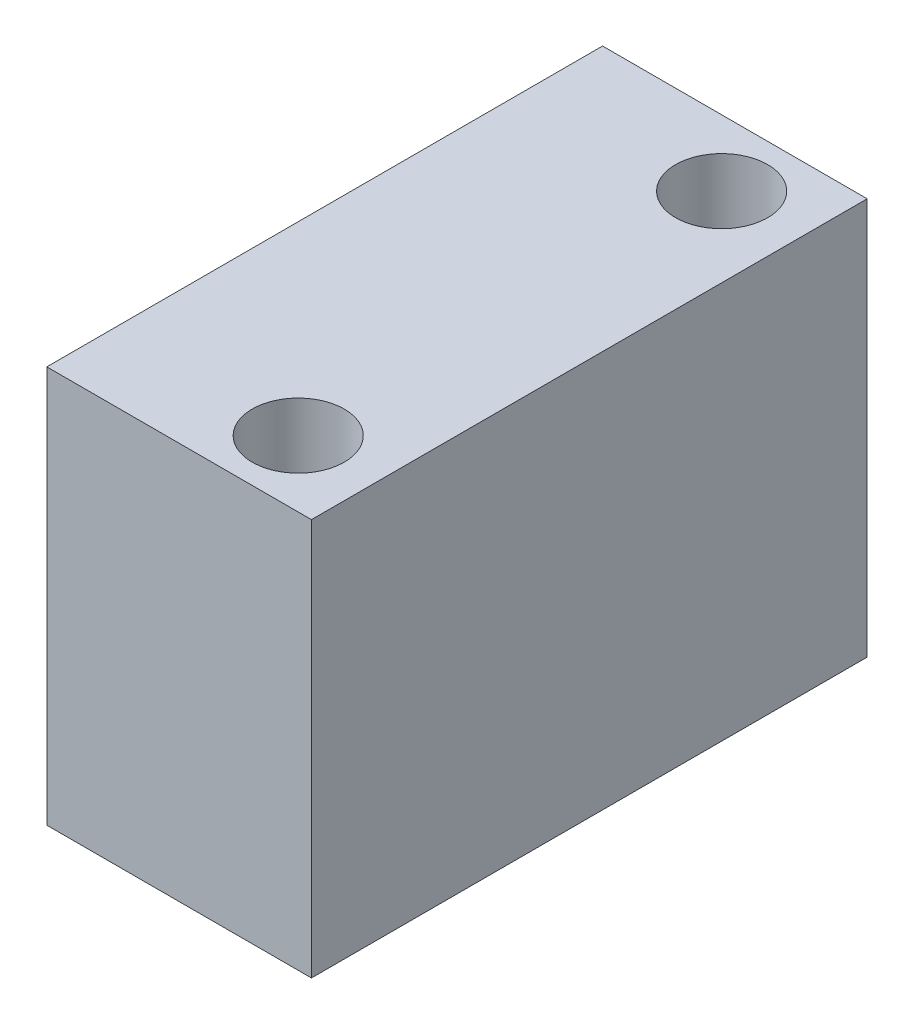
from build123d import *

# Parameters (mm, degrees)
SKETCH1_W           = 3.81
SKETCH1_H           = 13.335
SKETCH1_R           = 1.1049
BOSS_EXTRUDE1_DEPTH = 9.525
SKETCH2_W           = 2.54
SKETCH2_H           = 13.335
BOSS_EXTRUDE2_DEPTH = 9.525


with BuildPart() as part:
    # Sketch1 → Boss-Extrude1 (new body)
    with BuildSketch(Plane(origin=(0, 0, 0), x_dir=(1, 0, 0), z_dir=(0, 1, 0))):
        Rectangle(SKETCH1_W, SKETCH1_H)
        with Locations(Location((0, 5.08, 0), (0, 0, 90))):
            Circle(SKETCH1_R, mode=Mode.SUBTRACT)
        with Locations(Location((0, -5.08, 0), (0, 0, 90))):
            Circle(SKETCH1_R, mode=Mode.SUBTRACT)
    extrude(amount=BOSS_EXTRUDE1_DEPTH)

    # Sketch2 → Boss-Extrude2 (add)
    with BuildSketch(Plane(origin=(0, 9.525, 0), x_dir=(1, 0, 0), z_dir=(0, 1, 0))):
        with Locations((-3.175, 0)):
            Rectangle(SKETCH2_W, SKETCH2_H)
    extrude(amount=-BOSS_EXTRUDE2_DEPTH)


solid = part.part
